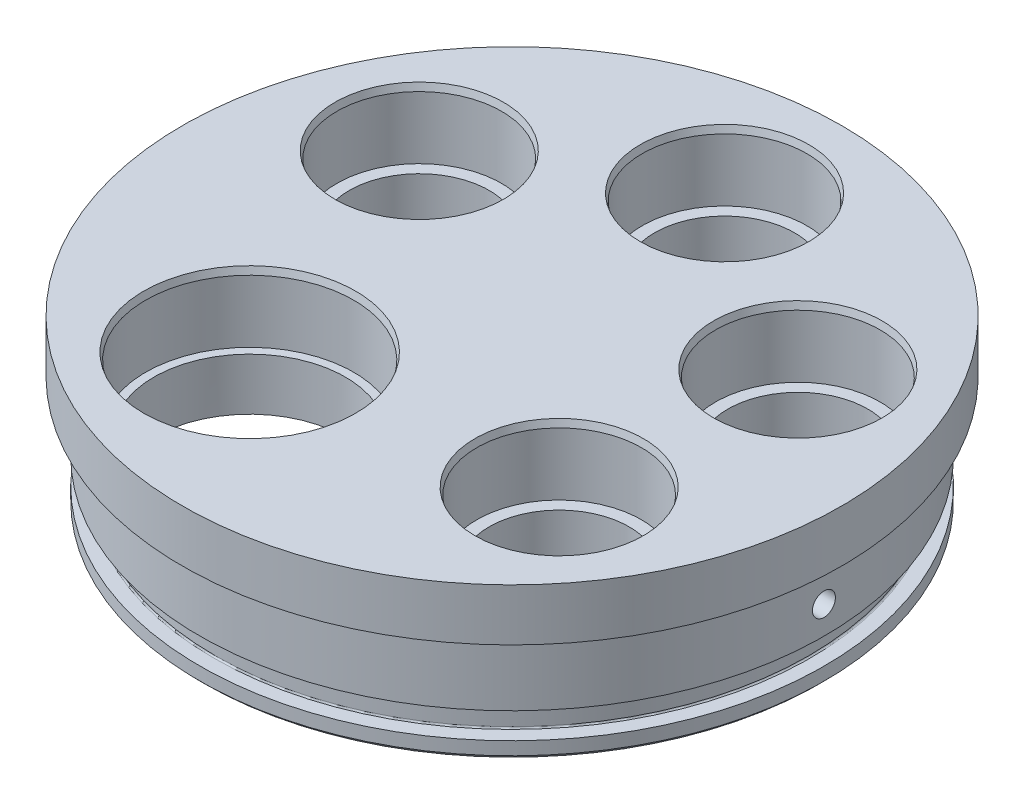
from build123d import *
from OCP.BRepFilletAPI import BRepFilletAPI_MakeChamfer

# Parameters (mm, degrees)
FILLET1_R                          = 3.175
M4_CIRPATTERN1_COUNT               = 2
SKETCH6_R                          = 15.0749
F_0_88_FEEDTHRU_CUT_EXTRUDE2_DEPTH = 12.7
SKETCH7_R                          = 12.827
F_0_88_FEEDTHRU_CUT_EXTRUDE3_DEPTH = 88.078738909
SKETCH8_R                          = 19.05
F_1_5_FEEDTHRU_CUT_EXTRUDE4_DEPTH  = 12.7
SKETCH9_R                          = 17.526
F_1_5_FEEDTHRU_CUT_EXTRUDE5_DEPTH  = 88.078738909
M27X3_TAPPED_HOLE1_D               = 25
M27X3_TAPPED_HOLE1_DEPTH           = 12.7
M4X0_7_TAPPED_HOLE1_D              = 3.3
M4X0_7_TAPPED_HOLE1_DEPTH          = 12.10056
M4X0_7_TAPPED_HOLE1_TIP            = 0.991420021
CHAMFER1_SIZE                      = 0.79375
FILLET2_R                          = 0.254
CHAMFER2_SIZE                      = 1.27
CHAMFER2_SIZE2                     = 0.340295474


with BuildPart() as part:
    # Sketch1 → Revolve1 (revolve)
    with BuildSketch(Plane.XY):
        Polygon((52.7431, 21.954), (52.7431, 29.8788), (17, 29.8788), (0, 29.8788), (0, 52.1038), (60.325, 52.1038), (60.325, 42.5788), (57.1246, 42.5788), (57.1246, 29.8788), (54.3306, 29.8788), (54.3306, 25.129), (57.1246, 25.129), (57.1246, 21.954), align=None)
    revolve(axis=Axis((0, 0, 0), (0, 1, 0)))

    # Fillet1
    fillet1_edges = [part.edges().sort_by_distance(p)[0] for p in [
        (-52.7431, 29.8788, 0),
    ]]
    fillet(fillet1_edges, radius=FILLET1_R)

    # Sketch5 → Tapped Hole for M4x0.7 Helicoil1 (revolve, cut)
    with BuildSketch(Plane(origin=(57.1246, 34.9588, 0), x_dir=(0, 0, -1), z_dir=(0, 1, 0))):
        Polygon((0, 0), (0, 11.4624473), (2.1, 10.20064), (2.1, 0), align=None)
    tapped_hole_for_m4x0_7_helicoil1 = revolve(axis=Axis((63.4746, 34.9588, 0), (-1, 0, 0)), mode=Mode.SUBTRACT)

    # M4 CirPattern1: Tapped Hole for M4x0.7 Helicoil1 ×2 about axis
    m4_cirpattern1_axis = Axis((0, 0, 0), (0, -1, 0))
    for i in range(1, M4_CIRPATTERN1_COUNT):
        add(tapped_hole_for_m4x0_7_helicoil1.rotate(m4_cirpattern1_axis, i * 360 / M4_CIRPATTERN1_COUNT), mode=Mode.SUBTRACT)

    # Sketch6 → 0.88 feedthru Cut-Extrude2 (cut)
    with BuildSketch(Plane(origin=(0, 52.1038, 0), x_dir=(1, 0, 0), z_dir=(0, 1, 0))):
        with Locations((0, 38.89375)):
            Circle(SKETCH6_R)
        with Locations((34.652531078, 17.661423469)):
            Circle(SKETCH6_R)
        with Locations((-34.652531078, 17.661423469)):
            Circle(SKETCH6_R)
        with Locations((31.471021727, -22.85385264)):
            Circle(SKETCH6_R)
    extrude(amount=-F_0_88_FEEDTHRU_CUT_EXTRUDE2_DEPTH, mode=Mode.SUBTRACT)

    # Sketch7 → 0.88 feedthru Cut-Extrude3 (cut, through all)
    with BuildSketch(Plane(origin=(0, 39.4038, 0), x_dir=(1, 0, 0), z_dir=(0, 1, 0))):
        with Locations((0, 38.89375)):
            Circle(SKETCH7_R)
        with Locations((34.652531078, 17.661423469)):
            Circle(SKETCH7_R)
        with Locations((-34.652531078, 17.661423469)):
            Circle(SKETCH7_R)
        with Locations((31.471021727, -22.85385264)):
            Circle(SKETCH7_R)
    extrude(amount=-F_0_88_FEEDTHRU_CUT_EXTRUDE3_DEPTH, mode=Mode.SUBTRACT)

    # Sketch8 → 1.5 feedthru Cut-Extrude4 (cut)
    with BuildSketch(Plane(origin=(0, 52.1038, 0), x_dir=(1, 0, 0), z_dir=(0, 1, 0))):
        with Locations((-18.246530612, -29.779518895)):
            Circle(SKETCH8_R)
    extrude(amount=-F_1_5_FEEDTHRU_CUT_EXTRUDE4_DEPTH, mode=Mode.SUBTRACT)

    # Sketch9 → 1.5 feedthru Cut-Extrude5 (cut, through all)
    with BuildSketch(Plane(origin=(0, 39.4038, 0), x_dir=(1, 0, 0), z_dir=(0, 1, 0))):
        with Locations((-18.246530612, -29.779518895)):
            Circle(SKETCH9_R)
    extrude(amount=-F_1_5_FEEDTHRU_CUT_EXTRUDE5_DEPTH, mode=Mode.SUBTRACT)

    # M27x3 Tapped Hole1
    with Locations(Plane(origin=(0, 29.8788, 0), x_dir=(-1, 0, 0), z_dir=(0, -1, 0))):
        with Locations((0, 0)):
            Hole(M27X3_TAPPED_HOLE1_D / 2, depth=M27X3_TAPPED_HOLE1_DEPTH)

    # M4x0.7 Tapped Hole1
    with Locations(Plane(origin=(0, 29.8788, 0), x_dir=(-1, 0, 0), z_dir=(0, -1, 0))):
        with Locations((-22.393469388, 36.547591371), (42.39132394, -6.337946111), (-13.602834619, -40.646731684)):
            Hole(M4X0_7_TAPPED_HOLE1_D / 2, depth=M4X0_7_TAPPED_HOLE1_DEPTH)
            with Locations((0, 0, -(M4X0_7_TAPPED_HOLE1_DEPTH + M4X0_7_TAPPED_HOLE1_TIP / 2))):  # 118° drill point
                Cone(0, M4X0_7_TAPPED_HOLE1_D / 2, M4X0_7_TAPPED_HOLE1_TIP, mode=Mode.SUBTRACT)

    # Chamfer1
    chamfer1_edges = [part.edges().sort_by_distance(p)[0] for p in [
        (-57.1246, 21.954, 0),
    ]]
    chamfer(chamfer1_edges, length=CHAMFER1_SIZE)

    # Fillet2
    fillet2_edges = [part.edges().sort_by_distance(p)[0] for p in [
        (-54.3306, 25.129, 0),
        (-54.3306, 29.8788, 0),
    ]]
    fillet(fillet2_edges, radius=FILLET2_R)

    # Chamfer2: one chamfer whose edges measure the first distance from different faces: ONE call of the kernel's chamfer builder (chamfer() names one face for all edges)
    chamfer2_edges_1 = [part.edges().sort_by_distance(p)[0] for p in [
        (-37.296530612, 52.1038, 29.779518895),
    ]]
    chamfer2_side_1 = [part.faces().sort_by_distance(p)[0] for p in [
        (-37.296530612, 45.7538, 29.779518895),
    ]]
    chamfer2_edges_2 = [part.edges().sort_by_distance(p)[0] for p in [
        (19.577631078, 52.1038, -17.661423469),
    ]]
    chamfer2_side_2 = [part.faces().sort_by_distance(p)[0] for p in [
        (19.577631078, 45.7538, -17.661423469),
    ]]
    chamfer2_edges_3 = [part.edges().sort_by_distance(p)[0] for p in [
        (-15.0749, 52.1038, -38.89375),
    ]]
    chamfer2_side_3 = [part.faces().sort_by_distance(p)[0] for p in [
        (-15.0749, 45.7538, -38.89375),
    ]]
    chamfer2_edges_4 = [part.edges().sort_by_distance(p)[0] for p in [
        (-49.727431078, 52.1038, -17.661423469),
    ]]
    chamfer2_side_4 = [part.faces().sort_by_distance(p)[0] for p in [
        (-49.727431078, 45.7538, -17.661423469),
    ]]
    chamfer2_edges_5 = [part.edges().sort_by_distance(p)[0] for p in [
        (16.396121727, 52.1038, 22.85385264),
    ]]
    chamfer2_side_5 = [part.faces().sort_by_distance(p)[0] for p in [
        (16.396121727, 45.7538, 22.85385264),
    ]]
    chamfer2 = BRepFilletAPI_MakeChamfer(part.part.solid().wrapped)
    for e in chamfer2_edges_1:
        chamfer2.Add(CHAMFER2_SIZE, CHAMFER2_SIZE2, e.wrapped, chamfer2_side_1[0].wrapped)  # the first distance lies on this face
    for e in chamfer2_edges_2:
        chamfer2.Add(CHAMFER2_SIZE, CHAMFER2_SIZE2, e.wrapped, chamfer2_side_2[0].wrapped)  # the first distance lies on this face
    for e in chamfer2_edges_3:
        chamfer2.Add(CHAMFER2_SIZE, CHAMFER2_SIZE2, e.wrapped, chamfer2_side_3[0].wrapped)  # the first distance lies on this face
    for e in chamfer2_edges_4:
        chamfer2.Add(CHAMFER2_SIZE, CHAMFER2_SIZE2, e.wrapped, chamfer2_side_4[0].wrapped)  # the first distance lies on this face
    for e in chamfer2_edges_5:
        chamfer2.Add(CHAMFER2_SIZE, CHAMFER2_SIZE2, e.wrapped, chamfer2_side_5[0].wrapped)  # the first distance lies on this face
    add(Compound.cast(chamfer2.Shape()), mode=Mode.REPLACE)


solid = part.part
